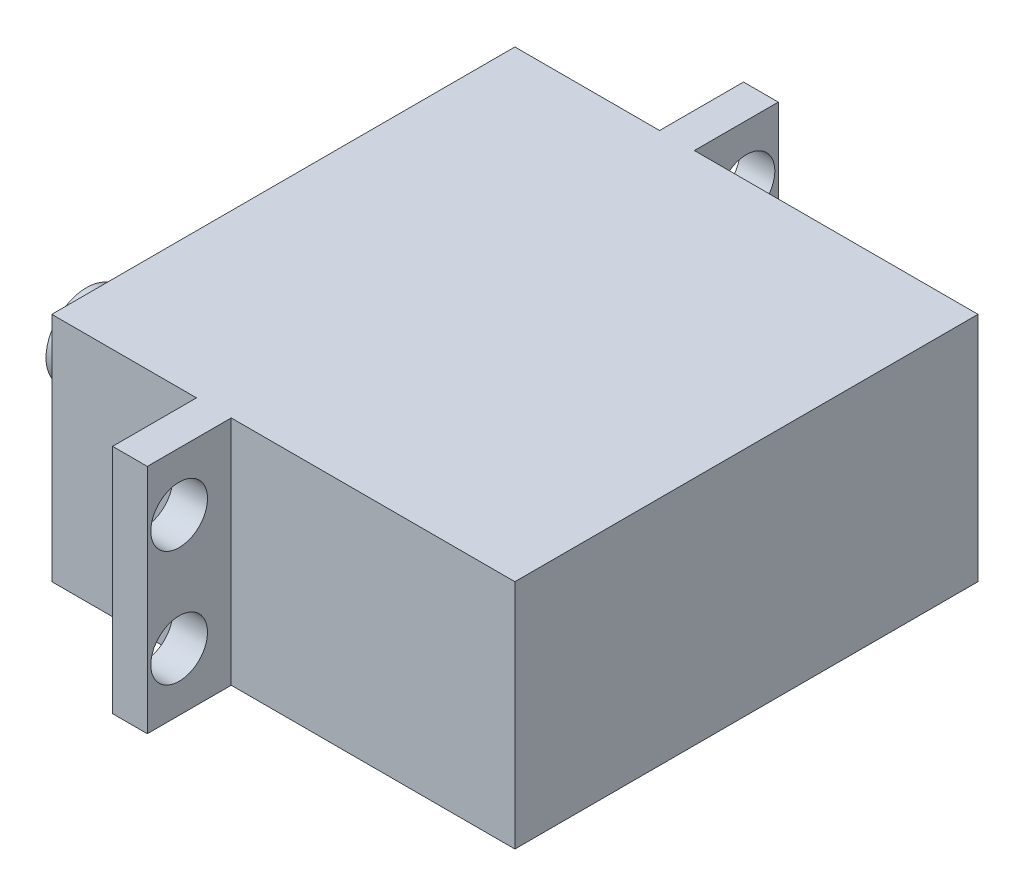
from build123d import *

# Parameters (mm, degrees)
SKETCH_1_W           = 40
SKETCH_1_H           = 40
EXTRUDE_1_DEPTH      = 20
EXTRUDE_2_DEPTH      = 7.25
EXTRUDE_2_DEPTH_BACK = 47.25
SKETCH_4_W           = 3
SKETCH_4_H           = 20
SKETCH_5_R           = 2.45
CUT_EXTRUDE_3_DEPTH  = 7.25
SKETCH_6_R           = 3.5
EXTRUDE_3_DEPTH      = 7
SKETCH_7_R           = 5
EXTRUDE_4_DEPTH      = 2.5


with BuildPart() as part:
    # 草图1 → 凸台-拉伸1 (new body)
    with BuildSketch(Plane(origin=(0, 0, 0), x_dir=(1, 0, 0), z_dir=(0, 1, 0))):
        Rectangle(SKETCH_1_W, SKETCH_1_H)
    extrude(amount=EXTRUDE_1_DEPTH)

    # 草图4 → 凸台-拉伸2 (add, two sides: drawn at the far end of the back side and taken through both)
    with BuildSketch(Plane(origin=(0, 0, -20), x_dir=(-1, 0, 0), z_dir=(0, 0, -1)).offset(-EXTRUDE_2_DEPTH_BACK)):
        with Locations((6, 10)):
            Rectangle(SKETCH_4_W, SKETCH_4_H)
    extrude(amount=EXTRUDE_2_DEPTH + EXTRUDE_2_DEPTH_BACK)

    # 草图5 → 切除-拉伸3 (cut)
    with BuildSketch(Plane.ZY.offset(7.5)):
        with Locations((-24.5, 15)):
            Circle(SKETCH_5_R)
        with Locations((24.5, 15)):
            Circle(SKETCH_5_R)
        with Locations((24.5, 5)):
            Circle(SKETCH_5_R)
        with Locations((-24.5, 5)):
            Circle(SKETCH_5_R)
    extrude(amount=-CUT_EXTRUDE_3_DEPTH, mode=Mode.SUBTRACT)

    # 草图6 → 凸台-拉伸3 (add)
    with BuildSketch(Plane.ZY.offset(20)):
        with Locations(Location((10, 10, 0), (0, 0, 180))):
            Circle(SKETCH_6_R)
    extrude(amount=EXTRUDE_3_DEPTH)

    # 草图7 → 凸台-拉伸4 (add)
    with BuildSketch(Plane.ZY.offset(20)):
        with Locations(Location((10, 10, 0), (0, 0, 180))):
            Circle(SKETCH_7_R)
    extrude(amount=EXTRUDE_4_DEPTH)


solid = part.part
